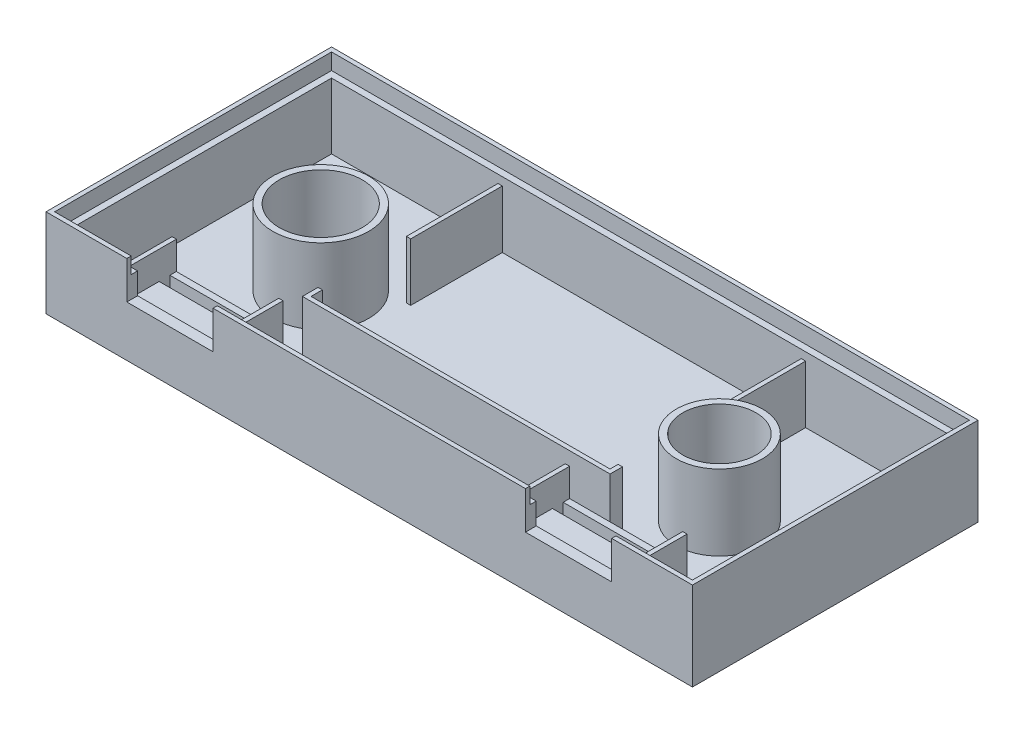
from build123d import *

# Parameters (mm, degrees)
SKETCH_1_W           = 120
SKETCH_1_H           = 53
EXTRUDE_2_DEPTH      = 16.4
SKETCH_4_W           = 116
SKETCH_4_H           = 49
CUT_EXTRUDE_5_DEPTH  = 15.2
SKETCH_5_W           = 118.4
SKETCH_5_H           = 51.4
CUT_EXTRUDE_6_DEPTH  = 3
SKETCH_6_W           = 57.1
SKETCH_6_H           = 36.3
EXTRUDE_3_DEPTH      = 10.7
SKETCH_7_W           = 55.5
SKETCH_7_H           = 35.5
CUT_EXTRUDE_7_DEPTH  = 10.7
SKETCH_8_W           = 3.401063497
SKETCH_8_H           = 16.4
CUT_EXTRUDE_8_DEPTH  = 10.7
SKETCH_9_R           = 8.9
EXTRUDE_4_DEPTH      = 14
SKETCH_10_R          = 7.7
CUT_EXTRUDE_9_DEPTH  = 14
SKETCH_12_W          = 1.431066628
SKETCH_12_H          = 20
CUT_EXTRUDE_10_DEPTH = 10.7
SKETCH_11_R          = 8
EXTRUDE_8_DEPTH      = 14
SKETCH_13_R          = 6.8
CUT_EXTRUDE_11_DEPTH = 14
SKETCH_14_W          = 22.6
SKETCH_14_H          = 8.7
EXTRUDE_9_DEPTH      = 12.2
SKETCH_15_W          = 21
SKETCH_15_H          = 9.750364289
CUT_EXTRUDE_12_DEPTH = 5.2
SKETCH_16_W          = 16
SKETCH_16_H          = 2
CUT_EXTRUDE_13_DEPTH = 7
SKETCH_18_W          = 21
SKETCH_18_H          = 2
CUT_EXTRUDE_14_DEPTH = 7
SKETCH_19_W          = 20.6
SKETCH_19_H          = 8.7
EXTRUDE_10_DEPTH     = 12.2
SKETCH_21_W          = 19
SKETCH_21_H          = 9.521560297
CUT_EXTRUDE_15_DEPTH = 5.2
SKETCH_23_W          = 16
SKETCH_23_H          = 2
CUT_EXTRUDE_16_DEPTH = 7
SKETCH_24_W          = 19
SKETCH_24_H          = 2
CUT_EXTRUDE_17_DEPTH = 7
SKETCH_25_R          = 1.2
CUT_EXTRUDE_18_DEPTH = 5
SKETCH_26_R          = 1.2
CUT_EXTRUDE_19_DEPTH = 5
SKETCH_27_R          = 1.2
CUT_EXTRUDE_20_DEPTH = 5
SKETCH_28_R          = 1.2
CUT_EXTRUDE_21_DEPTH = 5


with BuildPart() as part:
    # 草图1 → 凸台-拉伸2 (new body)
    with BuildSketch(Plane(origin=(0, 0, 0), x_dir=(1, 0, 0), z_dir=(0, 1, 0))):
        with Locations((-60, 26.5)):
            Rectangle(SKETCH_1_W, SKETCH_1_H)
    extrude(amount=EXTRUDE_2_DEPTH)

    # 草图4 → 切除-拉伸5 (cut)
    with BuildSketch(Plane(origin=(0, 16.4, 0), x_dir=(1, 0, 0), z_dir=(0, 1, 0))):
        with Locations((-60, 26.5)):
            Rectangle(SKETCH_4_W, SKETCH_4_H)
    extrude(amount=-CUT_EXTRUDE_5_DEPTH, mode=Mode.SUBTRACT)

    # 草图5 → 切除-拉伸6 (cut)
    with BuildSketch(Plane(origin=(0, 16.4, 0), x_dir=(1, 0, 0), z_dir=(0, 1, 0))):
        with Locations((-60, 26.5)):
            Rectangle(SKETCH_5_W, SKETCH_5_H)
    extrude(amount=-CUT_EXTRUDE_6_DEPTH, mode=Mode.SUBTRACT)

    # 草图6 → 凸台-拉伸3 (add)
    with BuildSketch(Plane(origin=(0, 1.2, 0), x_dir=(1, 0, 0), z_dir=(0, 1, 0))):
        with Locations((-58.55, 32.85)):
            Rectangle(SKETCH_6_W, SKETCH_6_H)
    extrude(amount=EXTRUDE_3_DEPTH)

    # 草图7 → 切除-拉伸7 (cut)
    with BuildSketch(Plane(origin=(0, 11.9, 0), x_dir=(1, 0, 0), z_dir=(0, 1, 0))):
        with Locations((-58.55, 33.25)):
            Rectangle(SKETCH_7_W, SKETCH_7_H)
    extrude(amount=-CUT_EXTRUDE_7_DEPTH, mode=Mode.SUBTRACT)

    # 草图8 → 切除-拉伸8 (cut)
    with BuildSketch(Plane(origin=(0, 11.9, 0), x_dir=(1, 0, 0), z_dir=(0, 1, 0))):
        with Locations((-86.528295274, 25.8)):
            Rectangle(SKETCH_8_W, SKETCH_8_H)
    extrude(amount=-CUT_EXTRUDE_8_DEPTH, mode=Mode.SUBTRACT)

    # 草图9 → 凸台-拉伸4 (add)
    with BuildSketch(Plane(origin=(0, 1.2, 0), x_dir=(1, 0, 0), z_dir=(0, 1, 0))):
        with Locations(Location((-97, 28, 0), (0, 0, 270))):
            Circle(SKETCH_9_R)
    extrude(amount=EXTRUDE_4_DEPTH)

    # 草图10 → 切除-拉伸9 (cut)
    with BuildSketch(Plane(origin=(0, 15.2, 0), x_dir=(1, 0, 0), z_dir=(0, 1, 0))):
        with Locations(Location((-97, 28, 0), (0, 0, 270))):
            Circle(SKETCH_10_R)
    extrude(amount=-CUT_EXTRUDE_9_DEPTH, mode=Mode.SUBTRACT)

    # 草图12 → 切除-拉伸10 (cut)
    with BuildSketch(Plane(origin=(0, 11.9, 0), x_dir=(1, 0, 0), z_dir=(0, 1, 0))):
        with Locations((-30.715533314, 27)):
            Rectangle(SKETCH_12_W, SKETCH_12_H)
    extrude(amount=-CUT_EXTRUDE_10_DEPTH, mode=Mode.SUBTRACT)

    # 草图11 → 凸台-拉伸8 (add)
    with BuildSketch(Plane(origin=(0, 1.2, 0), x_dir=(1, 0, 0), z_dir=(0, 1, 0))):
        with Locations(Location((-23, 28, 0), (0, 0, 270))):
            Circle(SKETCH_11_R)
    extrude(amount=EXTRUDE_8_DEPTH)

    # 草图13 → 切除-拉伸11 (cut)
    with BuildSketch(Plane(origin=(0, 15.2, 0), x_dir=(1, 0, 0), z_dir=(0, 1, 0))):
        with Locations(Location((-23, 28, 0), (0, 0, 270))):
            Circle(SKETCH_13_R)
    extrude(amount=-CUT_EXTRUDE_11_DEPTH, mode=Mode.SUBTRACT)

    # 草图14 → 凸台-拉伸9 (add)
    with BuildSketch(Plane(origin=(0, 1.2, 0), x_dir=(1, 0, 0), z_dir=(0, 1, 0))):
        with Locations((-23, 6.35)):
            Rectangle(SKETCH_14_W, SKETCH_14_H)
    extrude(amount=EXTRUDE_9_DEPTH)

    # 草图15 → 切除-拉伸12 (cut)
    with BuildSketch(Plane(origin=(0, 13.4, 0), x_dir=(1, 0, 0), z_dir=(0, 1, 0))):
        with Locations((-23, 6.875182145)):
            Rectangle(SKETCH_15_W, SKETCH_15_H)
    extrude(amount=-CUT_EXTRUDE_12_DEPTH, mode=Mode.SUBTRACT)

    # 草图16 → 切除-拉伸13 (cut)
    with BuildSketch(Plane(origin=(0, 16.4, 0), x_dir=(1, 0, 0), z_dir=(0, 1, 0))):
        with Locations((-23, 1)):
            Rectangle(SKETCH_16_W, SKETCH_16_H)
    extrude(amount=-CUT_EXTRUDE_13_DEPTH, mode=Mode.SUBTRACT)

    # 草图18 → 切除-拉伸14 (cut)
    with BuildSketch(Plane(origin=(0, 8.2, 0), x_dir=(1, 0, 0), z_dir=(0, 1, 0))):
        with Locations((-23, 8.5)):
            Rectangle(SKETCH_18_W, SKETCH_18_H)
    extrude(amount=-CUT_EXTRUDE_14_DEPTH, mode=Mode.SUBTRACT)

    # 草图19 → 凸台-拉伸10 (add)
    with BuildSketch(Plane(origin=(0, 1.2, 0), x_dir=(1, 0, 0), z_dir=(0, 1, 0))):
        with Locations((-97, 6.35)):
            Rectangle(SKETCH_19_W, SKETCH_19_H)
    extrude(amount=EXTRUDE_10_DEPTH)

    # 草图21 → 切除-拉伸15 (cut)
    with BuildSketch(Plane(origin=(0, 13.4, 0), x_dir=(1, 0, 0), z_dir=(0, 1, 0))):
        with Locations((-97, 6.760780149)):
            Rectangle(SKETCH_21_W, SKETCH_21_H)
    extrude(amount=-CUT_EXTRUDE_15_DEPTH, mode=Mode.SUBTRACT)

    # 草图23 → 切除-拉伸16 (cut)
    with BuildSketch(Plane(origin=(0, 16.4, 0), x_dir=(1, 0, 0), z_dir=(0, 1, 0))):
        with Locations((-97, 1)):
            Rectangle(SKETCH_23_W, SKETCH_23_H)
    extrude(amount=-CUT_EXTRUDE_16_DEPTH, mode=Mode.SUBTRACT)

    # 草图24 → 切除-拉伸17 (cut)
    with BuildSketch(Plane(origin=(0, 8.2, 0), x_dir=(1, 0, 0), z_dir=(0, 1, 0))):
        with Locations((-97, 8.5)):
            Rectangle(SKETCH_24_W, SKETCH_24_H)
    extrude(amount=-CUT_EXTRUDE_17_DEPTH, mode=Mode.SUBTRACT)

    # 草图25 → 切除-拉伸18 (cut)
    with BuildSketch(Plane(origin=(0, 1.2, 0), x_dir=(1, 0, 0), z_dir=(0, 1, 0))):
        with Locations(Location((-7, 7, 0), (0, 0, 270))):
            Circle(SKETCH_25_R)
    extrude(amount=-CUT_EXTRUDE_18_DEPTH, mode=Mode.SUBTRACT)

    # 草图26 → 切除-拉伸19 (cut)
    with BuildSketch(Plane(origin=(0, 1.2, 0), x_dir=(1, 0, 0), z_dir=(0, 1, 0))):
        with Locations(Location((-7, 46.4, 0), (0, 0, 270))):
            Circle(SKETCH_26_R)
    extrude(amount=-CUT_EXTRUDE_19_DEPTH, mode=Mode.SUBTRACT)

    # 草图27 → 切除-拉伸20 (cut)
    with BuildSketch(Plane(origin=(0, 1.2, 0), x_dir=(1, 0, 0), z_dir=(0, 1, 0))):
        with Locations(Location((-112.7, 7, 0), (0, 0, 270))):
            Circle(SKETCH_27_R)
    extrude(amount=-CUT_EXTRUDE_20_DEPTH, mode=Mode.SUBTRACT)

    # 草图28 → 切除-拉伸21 (cut)
    with BuildSketch(Plane(origin=(0, 1.2, 0), x_dir=(1, 0, 0), z_dir=(0, 1, 0))):
        with Locations(Location((-112.7, 46.4, 0), (0, 0, 270))):
            Circle(SKETCH_28_R)
    extrude(amount=-CUT_EXTRUDE_21_DEPTH, mode=Mode.SUBTRACT)


solid = part.part
